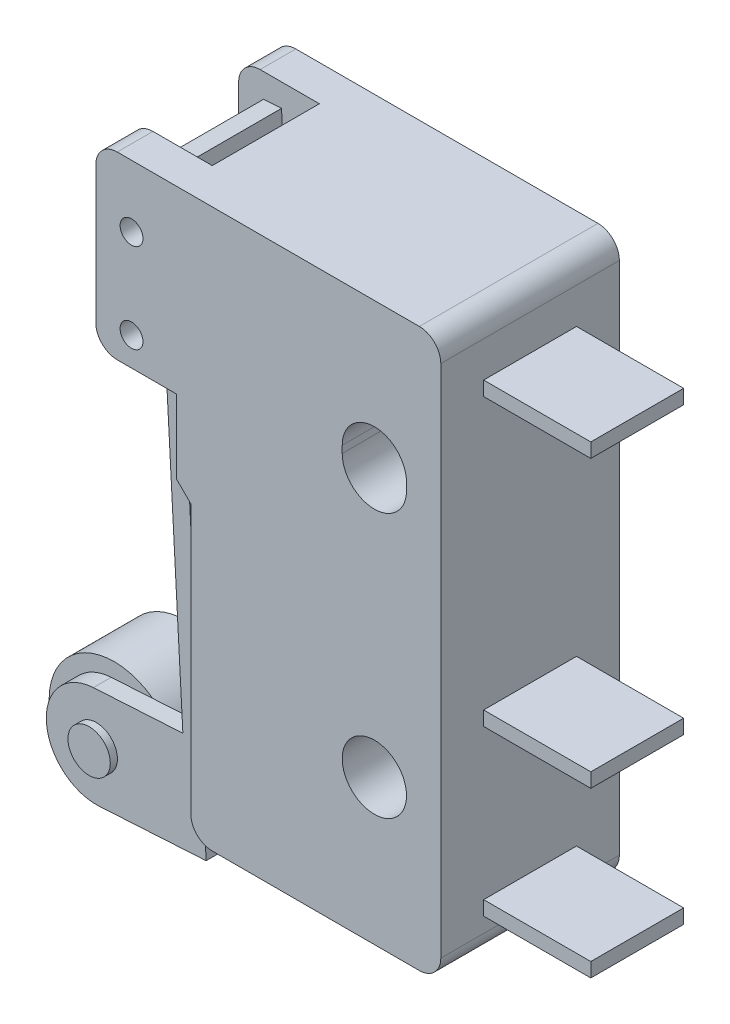
from build123d import *

# Parameters (mm, degrees)
SKETCH1_R                = 0.406598389
SKETCH1_R_2              = 1.143
BASE_EXTRUDE_DEPTH       = 6.35
SKETCH2_W                = 2.8702
SKETCH2_H                = 3.81
CUT_EXTRUDE1_DEPTH       = 33.262756347
SKETCH3_W                = 3.302
SKETCH3_H                = 0.508
BOSS_EXTRUDE1_DEPTH      = 3.81
BOSS_EXTRUDE2_DEPTH      = 3.81
SKETCH5_W                = 6.170551723
SKETCH5_H                = 2.54
CUT_EXTRUDE2_DEPTH       = 6.096
SKETCH6_R                = 2.3114
BOSS_EXTRUDE3_DEPTH      = 2.54
BOSS_EXTRUDE4_DEPTH      = 0.254
BOSS_EXTRUDE4_DEPTH_BACK = 4.064
SKETCH7_R                = 0.752584906


with BuildPart() as part:
    # Sketch1 → Base-Extrude (new body)
    with BuildSketch(Plane.XY):
        with BuildLine():
            Line((15.748192067, 1.405399301), (15.748192067, 10.955799301))
            Line((15.748192067, 10.955799301), (15.240192067, 11.463799301))
            Line((15.240192067, 11.463799301), (15.240192067, 14.079999301))
            Line((15.240192067, 14.079999301), (13.131992067, 14.079999301))
            ThreePointArc((13.131992067, 14.079999301), (12.5931767, 14.303183934), (12.369992067, 14.841999301))
            Line((12.369992067, 14.841999301), (12.369992067, 19.718799301))
            ThreePointArc((12.369992067, 19.718799301), (12.5931767, 20.257614668), (13.131992067, 20.480799301))
            Line((13.131992067, 20.480799301), (23.876192067, 20.480799301))
            ThreePointArc((23.876192067, 20.480799301), (24.415007435, 20.257614668), (24.638192067, 19.718799301))
            Line((24.638192067, 19.718799301), (24.638192067, 1.405399301))
            ThreePointArc((24.638192067, 1.405399301), (24.415007435, 0.866583934), (23.876192067, 0.643399301))
            Line((23.876192067, 0.643399301), (16.510192067, 0.643399301))
            ThreePointArc((16.510192067, 0.643399301), (15.9713767, 0.866583934), (15.748192067, 1.405399301))
        make_face()
        with Locations((13.639992067, 18.270999301)):
            Circle(SKETCH1_R, mode=Mode.SUBTRACT)
        with Locations((13.639992067, 15.095999301)):
            Circle(SKETCH1_R, mode=Mode.SUBTRACT)
        with Locations((22.275992067, 5.799599301)):
            Circle(SKETCH1_R_2, mode=Mode.SUBTRACT)
        with BuildLine():
            Line((23.418992067, 15.197599301), (23.418992067, 15.451599301))
            ThreePointArc((23.418992067, 15.451599301), (22.275992067, 16.594599301), (21.132992067, 15.451599301))
            Line((21.132992067, 15.451599301), (21.132992067, 15.197599301))
            ThreePointArc((21.132992067, 15.197599301), (22.275992067, 14.054599301), (23.418992067, 15.197599301))
        make_face(mode=Mode.SUBTRACT)
    extrude(amount=-BASE_EXTRUDE_DEPTH)

    # Sketch2 → Cut-Extrude1 (cut, through all)
    with BuildSketch(Plane(origin=(0, 20.480799301, 0), x_dir=(-1, 0, 0), z_dir=(0, 1, 0))):
        with Locations((-13.805092067, -3.175)):
            Rectangle(SKETCH2_W, SKETCH2_H)
    extrude(amount=-CUT_EXTRUDE1_DEPTH, mode=Mode.SUBTRACT)

    # Sketch3 → Boss-Extrude1 (add)
    with BuildSketch(Plane(origin=(24.638192067, 0, 0), x_dir=(0, 0, -1), z_dir=(1, 0, 0))):
        with Locations((3.175, 18.194799301)):
            Rectangle(SKETCH3_W, SKETCH3_H)
        with Locations((3.175, 8.034799301)):
            Rectangle(SKETCH3_W, SKETCH3_H)
        with Locations((3.175, 2.192799301)):
            Rectangle(SKETCH3_W, SKETCH3_H)
    extrude(amount=BOSS_EXTRUDE1_DEPTH)

    # Sketch4 → Boss-Extrude2 (add)
    with BuildSketch(Plane.XY.offset(-5.08)):
        with BuildLine():
            Line((13.259938371, 19.630855819), (14.196083485, 2.477721783))
            Line((14.196083485, 2.477721783), (11.012636903, 2.291505495))
            ThreePointArc((11.012636903, 2.291505495), (9.341497952, 0.412712637), (11.22029081, -1.258426314))
            Line((11.22029081, -1.258426314), (15.023756731, -1.035345448))
            Line((15.023756731, -1.035345448), (13.893994801, 19.665459923))
            Line((13.893994801, 19.665459923), (13.259938371, 19.630855819))
        make_face()
    extrude(amount=BOSS_EXTRUDE2_DEPTH)

    # Sketch5 → Cut-Extrude2 (cut)
    with BuildSketch(Plane(origin=(-0.096031652, 1.641701906, 0), x_dir=(-0.9982935348358413, -0.05839536201584024, 0), z_dir=(-0.05839536201584024, 0.9982935348358413, 0))):
        with Locations((-11.231269963, -3.175)):
            Rectangle(SKETCH5_W, SKETCH5_H)
    extrude(amount=-CUT_EXTRUDE2_DEPTH, mode=Mode.SUBTRACT)

    # Sketch6 → Boss-Extrude3 (add)
    with BuildSketch(Plane.XY.offset(-4.445)):
        with Locations(Location((11.116463856, 0.51653959, 0), (0, 0, 53.632575023))):
            Circle(SKETCH6_R)
    extrude(amount=BOSS_EXTRUDE3_DEPTH)

    # Sketch7 → Boss-Extrude4 (add, two sides: drawn at the far end of the back side and taken through both)
    with BuildSketch(Plane.XY.offset(-1.27).offset(-BOSS_EXTRUDE4_DEPTH_BACK)):
        with Locations(Location((11.116463856, 0.51653959, 0), (0, 0, 180))):
            Circle(SKETCH7_R)
    extrude(amount=BOSS_EXTRUDE4_DEPTH + BOSS_EXTRUDE4_DEPTH_BACK)


solid = part.part
